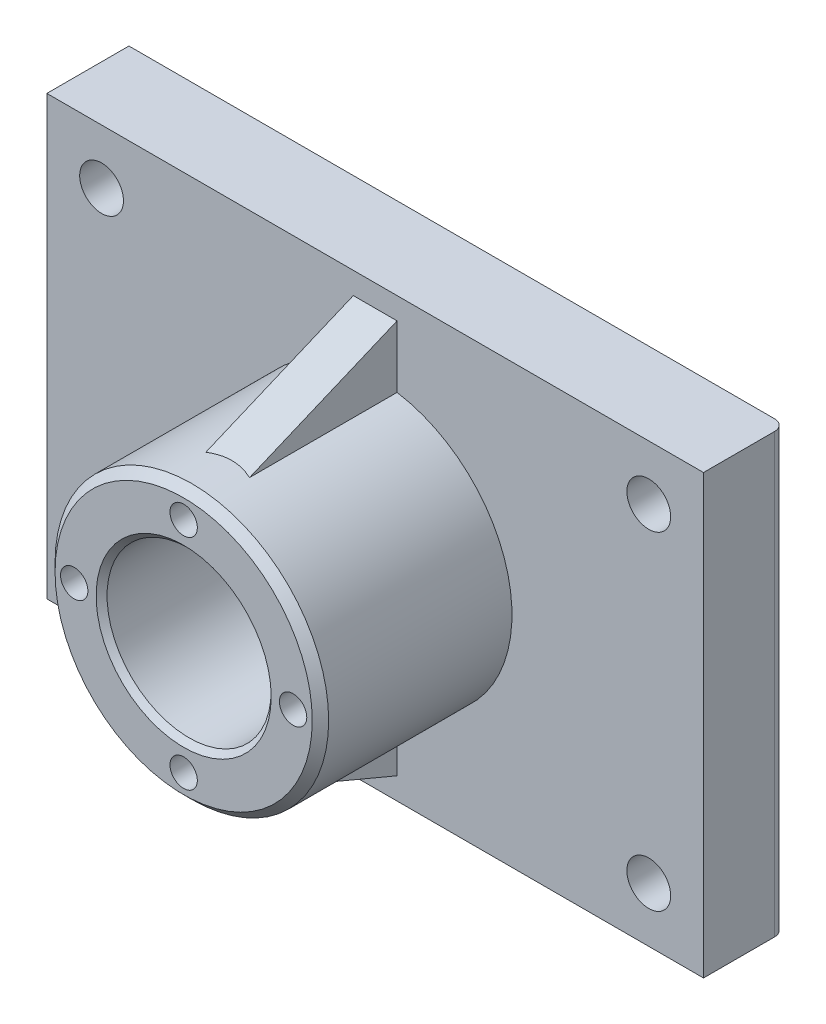
from build123d import *

# Parameters (mm, degrees)
SKETCH1_W               = 120
SKETCH1_H               = 80
BOSS_EXTRUDE1_DEPTH     = 15
SKETCH2_R               = 25
BOSS_EXTRUDE2_DEPTH     = 35
SKETCH3_R               = 15
CUT_EXTRUDE1_DEPTH      = 88.749643874
SKETCH4_R               = 4
CUT_EXTRUDE2_DEPTH      = 81.156097709
LPATTERN1_COUNT         = 2
LPATTERN1_PITCH         = 100
MIRROR1_COPY_1_SKETCH_R = 4
MIRROR1_COPY_1_DEPTH    = 81.156097709
SKETCH5_R               = 2.5
CUT_EXTRUDE3_DEPTH      = 12
CIRPATTERN1_COUNT       = 4
CHAMFER1_SIZE           = 1.5
CHAMFER2_SIZE           = 1
RIB6_REACH              = 89.75
SKETCH8_2_WALL_W        = 204.614781474
SKETCH8_2_WALL_H        = 8
RIB7_REACH              = 89.75
SKETCH9_WALL_W          = 204.614781474
SKETCH9_WALL_H          = 8
FILLET2_R               = 2


with BuildPart() as part:
    # Sketch1 → Boss-Extrude1 (new body)
    with BuildSketch(Plane.XY):
        Rectangle(SKETCH1_W, SKETCH1_H)
    extrude(amount=BOSS_EXTRUDE1_DEPTH)

    # Sketch2 → Boss-Extrude2 (add)
    with BuildSketch(Plane.XY.offset(15)):
        Circle(SKETCH2_R)
    extrude(amount=BOSS_EXTRUDE2_DEPTH)

    # Sketch3 → Cut-Extrude1 (cut, through all)
    with BuildSketch(Plane.XY.offset(50)):
        Circle(SKETCH3_R)
    extrude(amount=-CUT_EXTRUDE1_DEPTH, mode=Mode.SUBTRACT)

    # Sketch4 → Cut-Extrude2 (cut, through all)
    with BuildSketch(Plane.XY.offset(15)):
        with Locations((-50, 30)):
            Circle(SKETCH4_R)
    cut_extrude2 = extrude(amount=-CUT_EXTRUDE2_DEPTH, mode=Mode.SUBTRACT)

    # LPattern1: Cut-Extrude2 ×2
    with Locations(*[(i * LPATTERN1_PITCH, 0, 0) for i in range(1, LPATTERN1_COUNT)]):
        add(cut_extrude2, mode=Mode.SUBTRACT)

    # Mirror1: Cut-Extrude2 across plane
    add(cut_extrude2.mirror(Plane.ZX), mode=Mode.SUBTRACT)

    # Mirror1 copy 1 sketch → Mirror1 copy 1 (cut, through all)
    with BuildSketch(Plane(origin=(100, 0, 15), x_dir=(1, 0, 0), z_dir=(0, 0, 1))):
        with Locations((-50, -30)):
            Circle(MIRROR1_COPY_1_SKETCH_R)
    extrude(amount=-MIRROR1_COPY_1_DEPTH, mode=Mode.SUBTRACT)

    # Sketch5 → Cut-Extrude3 (cut)
    with BuildSketch(Plane.XY.offset(50)):
        with Locations((20, 0)):
            Circle(SKETCH5_R)
    cut_extrude3 = extrude(amount=-CUT_EXTRUDE3_DEPTH, mode=Mode.SUBTRACT)

    # CirPattern1: Cut-Extrude3 ×4 about axis
    cirpattern1_axis = Axis((0, 0, 52.5), (0, 0, -1))
    for i in range(1, CIRPATTERN1_COUNT):
        add(cut_extrude3.rotate(cirpattern1_axis, i * 360 / CIRPATTERN1_COUNT), mode=Mode.SUBTRACT)

    # Chamfer1
    chamfer1_edges = [part.edges().sort_by_distance(p)[0] for p in [
        (-25, 0, 50),
    ]]
    chamfer(chamfer1_edges, length=CHAMFER1_SIZE)

    # Chamfer2
    chamfer2_edges = [part.edges().sort_by_distance(p)[0] for p in [
        (-15, 0, 50),
    ]]
    chamfer(chamfer2_edges, length=CHAMFER2_SIZE)

    # Sketch8<2> wall → Rib6 (add, up to next)
    with BuildSketch(Plane(origin=(0, 30.75, 27.5), x_dir=(0, -0.387232484355, 0.921982105607), z_dir=(0, -0.921982105607, -0.387232484355)), mode=Mode.PRIVATE) as rib6_sk1:
        Rectangle(SKETCH8_2_WALL_W, SKETCH8_2_WALL_H)
    rib6_tool1 = extrude(rib6_sk1.sketch, amount=RIB6_REACH, mode=Mode.PRIVATE) - part.part
    add(rib6_tool1.solids().sort_by_distance((0, 30.75, 27.5))[0])

    # Sketch9 wall → Rib7 (add, up to next)
    with BuildSketch(Plane(origin=(0, -30.75, 27.5), x_dir=(0, 0.387232484355, 0.921982105607), z_dir=(0, -0.921982105607, 0.387232484355)), mode=Mode.PRIVATE) as rib7_sk1:
        Rectangle(SKETCH9_WALL_W, SKETCH9_WALL_H)
    rib7_tool1 = extrude(rib7_sk1.sketch, amount=-RIB7_REACH, mode=Mode.PRIVATE) - part.part
    add(rib7_tool1.solids().sort_by_distance((0, -30.75, 27.5))[0])

    # Fillet2
    fillet2_edges = [part.edges().sort_by_distance(p)[0] for p in [
        (60, 0, 0),
    ]]
    fillet(fillet2_edges, radius=FILLET2_R)


solid = part.part
